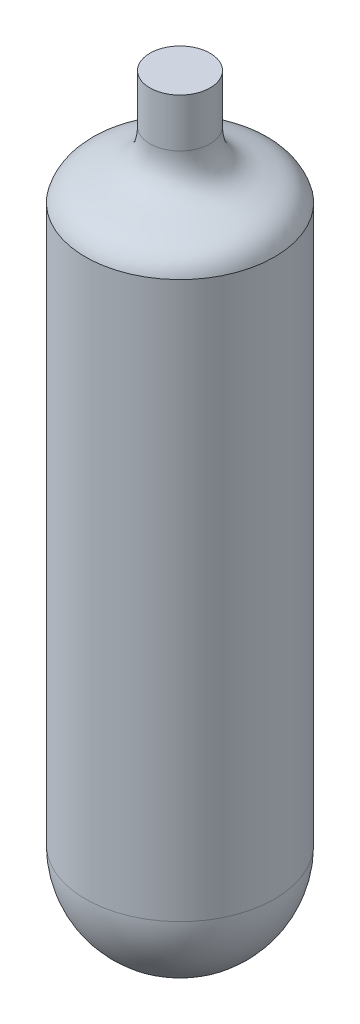
from build123d import *

# Parameters (mm, degrees)
SKETCH1_W = 3.5
SKETCH1_H = 11


with BuildPart() as part:
    # Sketch1 → Revolve1 (revolve)
    with BuildSketch(Plane.XY, mode=Mode.PRIVATE) as revolve1_sk:
        with BuildLine():
            Line((9.085974676, 39), (3.5, 39))
            Line((3.5, 39), (3.5, 28))
            Line((3.5, 28), (0, 28))
            Line((0, 28), (0, -39))
            ThreePointArc((0, -39), (7.778174593, -35.778174593), (11, -28))
            Line((11, -28), (11, 36.706189904))
            add(Edge.make_bspline(
                [(9.085974676, 39), (9.952667981, 38.554296202), (10.670284632, 37.900307222), (11, 36.706189904)],
                knots=[0.726528094, 0.726528094, 0.726528094, 0.726528094, 1, 1, 1, 1], degree=3))
        make_face()
        with BuildLine():
            Line((3.5, 44.089340843), (3.5, 39))
            Line((3.5, 39), (9.085974676, 39))
            add(Edge.make_bspline(
                [(3.5, 44.089340843), (3.569121253, 39.909476787), (6.831780935, 40.159236729), (9.085974676, 39)],
                knots=[0.015251506, 0.015251506, 0.015251506, 0.015251506, 0.726528094, 0.726528094, 0.726528094, 0.726528094], degree=3))
        make_face()
        with Locations((1.75, 33.5)):
            Rectangle(SKETCH1_W, SKETCH1_H)
        with BuildLine():
            Line((0, 50), (0, 39))
            Line((0, 39), (3.5, 39))
            Line((3.5, 39), (3.5, 44.089340843))
            add(Edge.make_bspline(
                [(3.5, 44.364387792), (3.498504063, 44.270630457), (3.498517872, 44.178967328), (3.5, 44.089340843)],
                knots=[0, 0, 0, 0, 0.015251506, 0.015251506, 0.015251506, 0.015251506], degree=3))
            Line((3.5, 44.364387792), (3.5, 50))
            Line((3.5, 50), (0, 50))
        make_face()
    revolve(revolve1_sk.sketch.rotate(Axis((0, 28, 0), (0, -1, 0)), 180), axis=Axis((0, 28, 0), (0, -1, 0)))


solid = part.part
